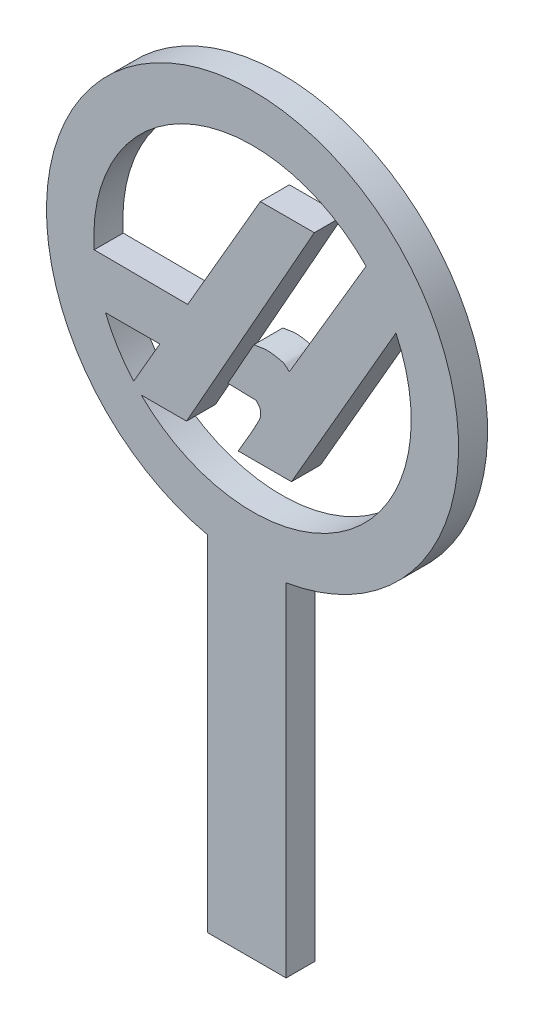
from build123d import *

# Parameters (mm, degrees)
BOSS_EXTRUDE1_DEPTH = 50


with BuildPart() as part:
    # Sketch1 → Boss-Extrude1 (new body)
    with BuildSketch(Plane.XY):
        with BuildLine():
            Line((514.521168615, -568.699042704), (379.382767374, -568.699042704))
            Line((379.382767374, -568.699042704), (379.382767374, 24.517199412))
            ThreePointArc((379.382767374, 24.517199412), (466.49674951, 725.452496248), (514.521168615, 20.759093835))
            Line((514.521168615, 20.759093835), (514.521168615, -568.699042704))
        make_face()
        with BuildLine():
            Line((652.184505988, 561.696856288), (520, 338))
            add(Edge.make_bspline(
                [(520, 338), (516, 341), (512.856486558, 345.810656353), (508, 347), (483.294181497, 353.050404531), (477.851743634, 351.141957272), (459, 348)],
                knots=[0, 0, 0, 0, 1, 1, 1, 2, 2, 2, 2], degree=3))
            Line((459, 348), (414.15311107, 268.000000001))
            Line((414.15311107, 268.000000001), (463, 267))
            add(Edge.make_bspline(
                [(463, 267), (465.333333333, 263.666666667), (469.050440025, 260.956499894), (470, 257), (471.16945492, 252.127271165), (471.128314939, 246.536671316), (469, 242), (458.288028235, 219.166586501), (444.333333333, 198), (432, 176)],
                knots=[0, 0, 0, 0, 1, 1, 1, 2, 2, 2, 3, 3, 3, 3], degree=3))
            Line((432, 176), (523.783724069, 176))
            Line((523.783724069, 176), (703.607534398, 487.787583679))
            ThreePointArc((703.607534398, 487.787583679), (614.979125151, 148.065376335), (264.996930573, 175.96943637))
            Line((264.996930573, 175.96943637), (342.999405137, 176))
            Line((342.999405137, 176), (562.999999995, 567.000000012))
            Line((562.999999995, 567.000000012), (470.080751257, 567.000000012))
            Line((470.080751257, 567.000000012), (344.999999995, 351.000000012))
            Line((344.999999995, 351.000000012), (183.999999995, 352.000000012))
            ThreePointArc((183.999999995, 352.000000012), (344.926101955, 620.204516968), (652.184505988, 561.696856288))
        make_face(mode=Mode.SUBTRACT)
        with BuildLine():
            Line((203.423883848, 268.000000001), (297, 268.000000001))
            Line((297, 268.000000001), (251.884299831, 189.799453042))
            ThreePointArc((251.884299831, 189.799453042), (224.339726467, 226.845833922), (203.423883848, 268.000000001))
        make_face(mode=Mode.SUBTRACT)
    extrude(amount=BOSS_EXTRUDE1_DEPTH)


solid = part.part
